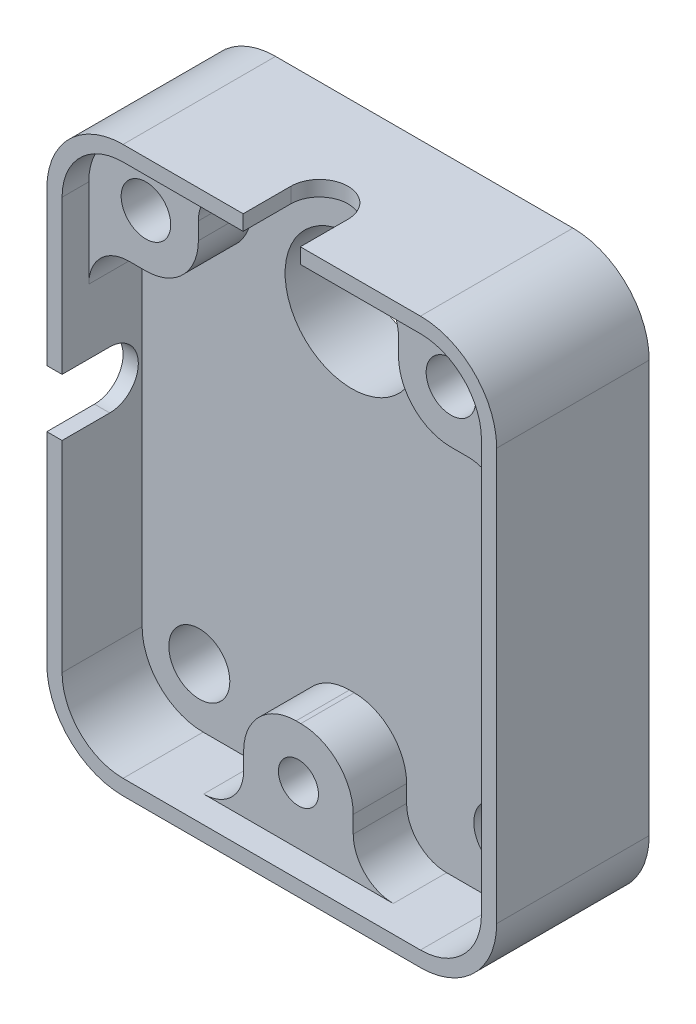
from build123d import *

# Parameters (mm, degrees)
SKETCH1_W                               = 23.6
SKETCH1_H                               = 29.6
BASIC_DEPTH                             = 8
SKETCH2_R                               = 3.5
F_7_0_HOLE_ROTATING_MAGNET_DEPTH        = 21.549452547
SKETCH4_R                               = 1.6
SKETCH4_R_2                             = 1.3
MOUNTING_HOLES_2_05_2_5_DEPTH           = 21.549452547
R4_BASIC_R                              = 4
PCB_LEVEL_DEPTH                         = 1.4
PCB_CLEARANCE_DEPTH                     = 4.2
R2_1_PCB_CLEARANCE_R                    = 2.1
R2_75_PCB_CLEARANCE_R                   = 2.75
CUT_OUT_1_DEPTH                         = 0.8
CUT_OUT_RESET_SWITCH_DEPTH              = 0.8
SKETCH13_R                              = 1.05
F_2_05_PCB_MOUNTING_HOLE_FOR_M2_5_DEPTH = 21.045947221


with BuildPart() as part:
    # Sketch1 → Basic (new body)
    with BuildSketch(Plane.XY):
        Rectangle(SKETCH1_W, SKETCH1_H)
    extrude(amount=BASIC_DEPTH)

    # Sketch2 → Ø7.0 Hole (Rotating Magnet) (cut, through all)
    with BuildSketch(Plane.XY.offset(8)):
        with Locations((0, 9)):
            Circle(SKETCH2_R)
    extrude(amount=-F_7_0_HOLE_ROTATING_MAGNET_DEPTH, mode=Mode.SUBTRACT)

    # Sketch4 → Mounting holes  Ø2.05 & Ø2.5 (cut, through all)
    with BuildSketch(Plane.XY.offset(8)):
        with Locations((8, -11)):
            Circle(SKETCH4_R)
        with Locations((-8, -11)):
            Circle(SKETCH4_R)
        with Locations((8, 11)):
            Circle(SKETCH4_R_2)
        with Locations((-8, 11)):
            Circle(SKETCH4_R_2)
    extrude(amount=-MOUNTING_HOLES_2_05_2_5_DEPTH, mode=Mode.SUBTRACT)

    # R4: Basic
    r4_basic_edges = [part.edges().sort_by_distance(p)[0] for p in [
        (11.8, -14.8, 4),
        (-11.8, -14.8, 4),
        (-11.8, 14.8, 4),
        (11.8, 14.8, 4),
    ]]
    fillet(r4_basic_edges, radius=R4_BASIC_R)

    # Sketch6 → PCB level (cut)
    with BuildSketch(Plane.XY.offset(8)):
        with BuildLine():
            Line((11, -10.8), (11, 10.8))
            ThreePointArc((11, 10.8), (10.0627417, 13.0627417), (7.8, 14))
            Line((7.8, 14), (-7.8, 14))
            ThreePointArc((-7.8, 14), (-10.0627417, 13.0627417), (-11, 10.8))
            Line((-11, 10.8), (-11, -10.8))
            ThreePointArc((-11, -10.8), (-10.0627417, -13.0627417), (-7.8, -14))
            Line((-7.8, -14), (7.8, -14))
            ThreePointArc((7.8, -14), (10.0627417, -13.0627417), (11, -10.8))
        make_face()
    extrude(amount=-PCB_LEVEL_DEPTH, mode=Mode.SUBTRACT)

    # Sketch9 → PCB Clearance (cut)
    with BuildSketch(Plane.XY.offset(8)):
        with BuildLine():
            Line((-11, 8.25), (-5.25, 8.25))
            Line((-5.25, 8.25), (-5.25, 14))
            Line((-5.25, 14), (5.25, 14))
            Line((5.25, 14), (5.25, 8.25))
            Line((5.25, 8.25), (11, 8.25))
            Line((11, 8.25), (11, -10.8))
            ThreePointArc((11, -10.8), (10.0627417, -13.0627417), (7.8, -14))
            Line((7.8, -14), (2.875, -14))
            Line((2.875, -14), (2.875, -8.25))
            Line((2.875, -8.25), (-2.875, -8.25))
            Line((-2.875, -8.25), (-2.875, -14))
            Line((-2.875, -14), (-7.8, -14))
            ThreePointArc((-7.8, -14), (-10.0627417, -13.0627417), (-11, -10.8))
            Line((-11, -10.8), (-11, 8.25))
        make_face()
    extrude(amount=-PCB_CLEARANCE_DEPTH, mode=Mode.SUBTRACT)

    # R2.1: PCB Clearance
    r2_1_pcb_clearance_edges = [part.edges().sort_by_distance(p)[0] for p in [
        (-11, 8.25, 5.2),
        (-5.25, 14, 5.2),
        (5.25, 14, 5.2),
        (11, 8.25, 5.2),
        (2.875, -14, 5.2),
        (-2.875, -14, 5.2),
    ]]
    fillet(r2_1_pcb_clearance_edges, radius=R2_1_PCB_CLEARANCE_R)

    # R2.75: PCB Clearance
    r2_75_pcb_clearance_edges = [part.edges().sort_by_distance(p)[0] for p in [
        (-5.25, 8.25, 5.2),
        (5.25, 8.25, 5.2),
        (2.875, -8.25, 5.2),
        (-2.875, -8.25, 5.2),
    ]]
    fillet(r2_75_pcb_clearance_edges, radius=R2_75_PCB_CLEARANCE_R)

    # Sketch11 → Cut-Out (1) (cut)
    with BuildSketch(Plane(origin=(0, 14.8, 0), x_dir=(1, 0, 0), z_dir=(0, 1, 0))):
        with BuildLine():
            Line((-1.5, -8), (-1.5, -5.5))
            ThreePointArc((-1.5, -5.5), (0, -4), (1.5, -5.5))
            Line((1.5, -5.5), (1.5, -8))
            Line((1.5, -8), (-1.5, -8))
        make_face()
    extrude(amount=-CUT_OUT_1_DEPTH, mode=Mode.SUBTRACT)

    # Sketch12 → Cut-Out Reset Switch (cut)
    with BuildSketch(Plane.ZY.offset(11.8)):
        with BuildLine():
            Line((8, -0.25), (5.5, -0.25))
            ThreePointArc((5.5, -0.25), (4, 1.25), (5.5, 2.75))
            Line((5.5, 2.75), (8, 2.75))
            Line((8, 2.75), (8, -0.25))
        make_face()
    extrude(amount=-CUT_OUT_RESET_SWITCH_DEPTH, mode=Mode.SUBTRACT)

    # Sketch13 → Ø2.05 PCB Mounting Hole for M2.5 (cut, through all)
    with BuildSketch(Plane.XY.offset(6.6)):
        with Locations((0, -11)):
            Circle(SKETCH13_R)
    extrude(amount=-F_2_05_PCB_MOUNTING_HOLE_FOR_M2_5_DEPTH, mode=Mode.SUBTRACT)


solid = part.part
